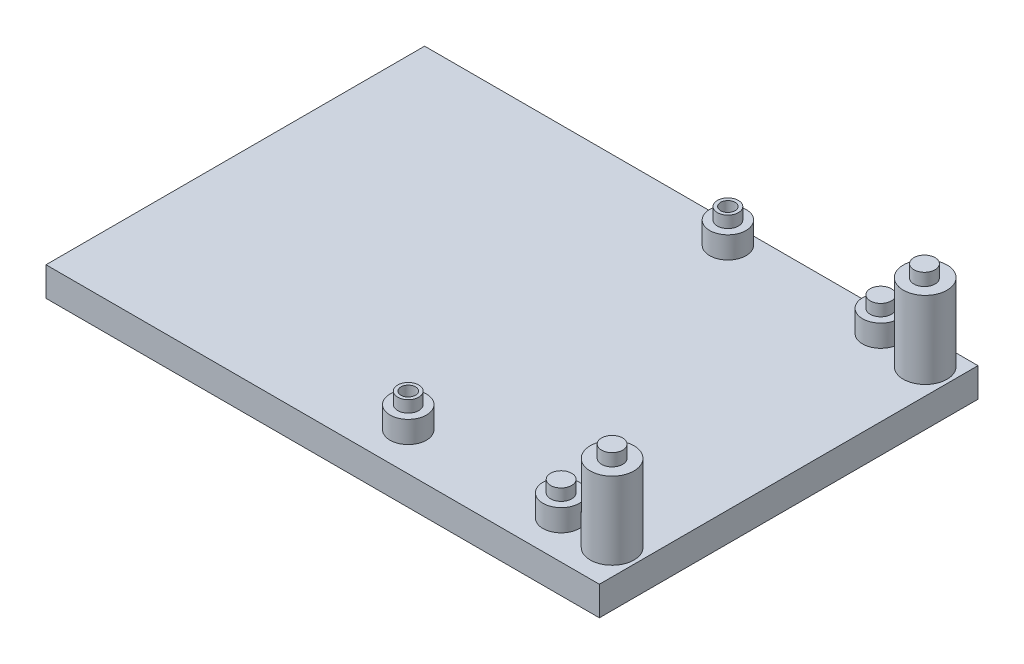
from build123d import *

# Parameters (mm, degrees)
SKETCH1_W           = 76
SKETCH1_H           = 48
SKETCH1_W_2         = 72
SKETCH1_H_2         = 44
BOSS_EXTRUDE1_DEPTH = 2
SKETCH2_W           = 76
SKETCH2_H           = 48
BOSS_EXTRUDE2_DEPTH = 2
SKETCH8_W           = 76
SKETCH8_H           = 4
BOSS_EXTRUDE7_DEPTH = 4
SKETCH3_R           = 2.5
SKETCH3_R_2         = 1
BOSS_EXTRUDE3_DEPTH = 3
SKETCH4_R           = 1.45
SKETCH4_R_2         = 1
BOSS_EXTRUDE4_DEPTH = 1.6
SKETCH5_R           = 3
BOSS_EXTRUDE5_DEPTH = 10.6
SKETCH7_R           = 1.45
BOSS_EXTRUDE6_DEPTH = 1.7


with BuildPart() as part:
    # Sketch1 → Boss-Extrude1 (new body)
    with BuildSketch(Plane(origin=(0, 0, 0), x_dir=(1, 0, 0), z_dir=(0, 1, 0))):
        with Locations((36, 22)):
            Rectangle(SKETCH1_W, SKETCH1_H)
        with Locations((36, 22)):
            Rectangle(SKETCH1_W_2, SKETCH1_H_2, mode=Mode.SUBTRACT)
    extrude(amount=BOSS_EXTRUDE1_DEPTH)

    # Sketch2 → Boss-Extrude2 (add)
    with BuildSketch(Plane(origin=(0, 2, 0), x_dir=(1, 0, 0), z_dir=(0, 1, 0))):
        with Locations((36, 22)):
            Rectangle(SKETCH2_W, SKETCH2_H)
    extrude(amount=BOSS_EXTRUDE2_DEPTH)

    # Sketch8 → Boss-Extrude7 (add)
    with BuildSketch(Plane(origin=(0, 0, -46), x_dir=(-1, 0, 0), z_dir=(0, 0, -1))):
        with Locations((-36, 2)):
            Rectangle(SKETCH8_W, SKETCH8_H)
    extrude(amount=BOSS_EXTRUDE7_DEPTH)

    # Sketch3 → Boss-Extrude3 (add)
    # profile 1 of 4: a face of its own
    with BuildSketch(Plane(origin=(0, 4, 0), x_dir=(1, 0, 0), z_dir=(0, 1, 0))):
        with Locations(Location((42.5, 3.25, 0), (0, 0, 90))):
            Circle(SKETCH3_R)
        with Locations(Location((42.5, 3.25, 0), (0, 0, 270))):
            Circle(SKETCH3_R_2, mode=Mode.SUBTRACT)
    # profile 2 of 4: a face of its own
    with BuildSketch(Plane(origin=(0, 4, 0), x_dir=(1, 0, 0), z_dir=(0, 1, 0))):
        with Locations(Location((63.5, 3.25, 0), (0, 0, 90))):
            Circle(SKETCH3_R)
    # profile 3 of 4: a face of its own
    with BuildSketch(Plane(origin=(0, 4, 0), x_dir=(1, 0, 0), z_dir=(0, 1, 0))):
        with Locations(Location((42.5, 47.15, 0), (0, 0, 90))):
            Circle(SKETCH3_R)
        with Locations(Location((42.5, 47.15, 0), (0, 0, 270))):
            Circle(SKETCH3_R_2, mode=Mode.SUBTRACT)
    # profile 4 of 4: a face of its own
    with BuildSketch(Plane(origin=(0, 4, 0), x_dir=(1, 0, 0), z_dir=(0, 1, 0))):
        with Locations(Location((63.5, 47.15, 0), (0, 0, 90))):
            Circle(SKETCH3_R)
    extrude(amount=BOSS_EXTRUDE3_DEPTH)

    # Sketch4 → Boss-Extrude4 (add)
    # profile 1 of 4: a face of its own
    with BuildSketch(Plane(origin=(0, 7, 0), x_dir=(1, 0, 0), z_dir=(0, 1, 0))):
        with Locations(Location((42.5, 3.25, 0), (0, 0, 270))):
            Circle(SKETCH4_R)
        with Locations(Location((42.5, 3.25, 0), (0, 0, 270))):
            Circle(SKETCH4_R_2, mode=Mode.SUBTRACT)
    # profile 2 of 4: a face of its own
    with BuildSketch(Plane(origin=(0, 7, 0), x_dir=(1, 0, 0), z_dir=(0, 1, 0))):
        with Locations(Location((42.5, 47.15, 0), (0, 0, 270))):
            Circle(SKETCH4_R)
        with Locations(Location((42.5, 47.15, 0), (0, 0, 270))):
            Circle(SKETCH4_R_2, mode=Mode.SUBTRACT)
    # profile 3 of 4: a face of its own
    with BuildSketch(Plane(origin=(0, 7, 0), x_dir=(1, 0, 0), z_dir=(0, 1, 0))):
        with Locations(Location((63.5, 3.25, 0), (0, 0, 270))):
            Circle(SKETCH4_R)
    # profile 4 of 4: a face of its own
    with BuildSketch(Plane(origin=(0, 7, 0), x_dir=(1, 0, 0), z_dir=(0, 1, 0))):
        with Locations(Location((63.5, 47.15, 0), (0, 0, 270))):
            Circle(SKETCH4_R)
    extrude(amount=BOSS_EXTRUDE4_DEPTH)

    # Sketch5 → Boss-Extrude5 (add)
    with BuildSketch(Plane(origin=(0, 4, 0), x_dir=(1, 0, 0), z_dir=(0, 1, 0))):
        with Locations(Location((70.5, 3.25, 0), (0, 0, 90))):
            Circle(SKETCH5_R)
        with Locations(Location((70.5, 46.25, 0), (0, 0, 90))):
            Circle(SKETCH5_R)
    extrude(amount=BOSS_EXTRUDE5_DEPTH)

    # Sketch7 → Boss-Extrude6 (add)
    with BuildSketch(Plane(origin=(0, 14.6, 0), x_dir=(1, 0, 0), z_dir=(0, 1, 0))):
        with Locations(Location((70.5, 3.25, 0), (0, 0, 270))):
            Circle(SKETCH7_R)
        with Locations(Location((70.5, 46.15, 0), (0, 0, 270))):
            Circle(SKETCH7_R)
    extrude(amount=BOSS_EXTRUDE6_DEPTH)


solid = part.part
